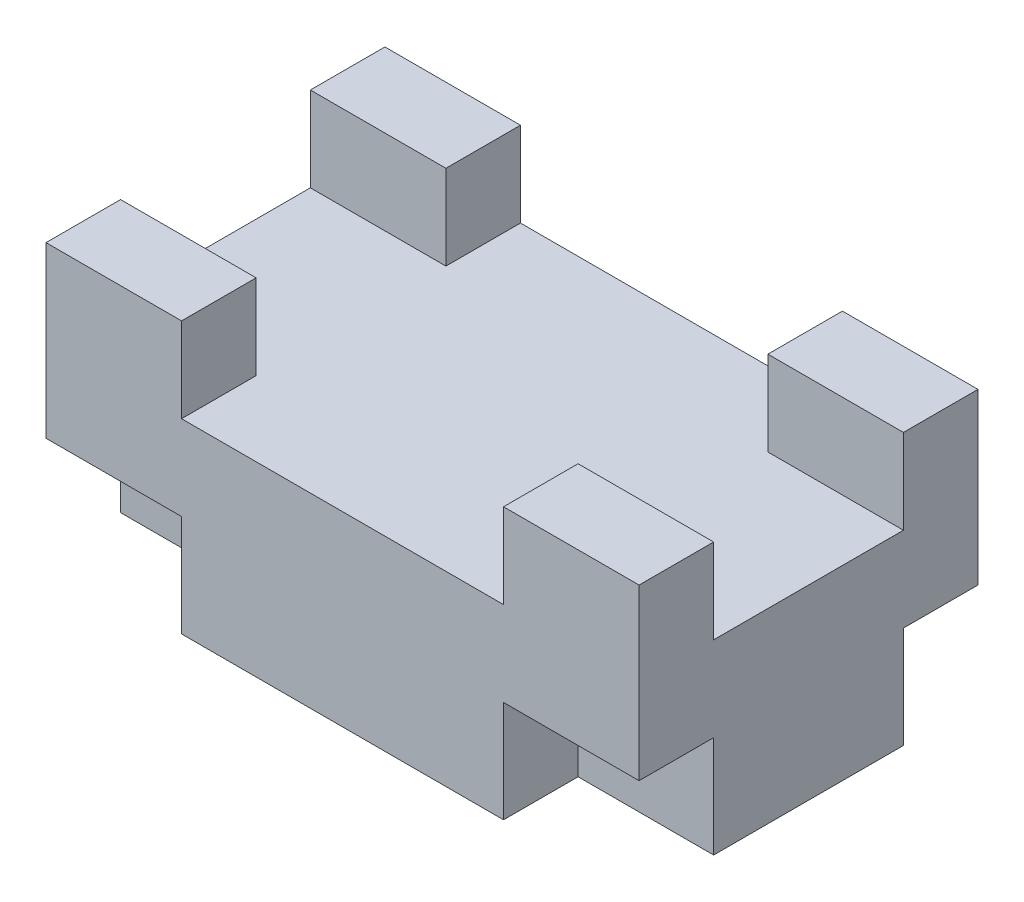
from build123d import *

# Parameters (mm, degrees)
BOSS_EXTRUDE1_DEPTH = 30
BOSS_EXTRUDE2_START = 30
SKETCH2_3_W         = 40
SKETCH2_3_H         = 22
BOSS_EXTRUDE2_DEPTH = 25
BOSS_EXTRUDE3_START = 55
SKETCH2_5_W         = 40
SKETCH2_5_H         = 22
BOSS_EXTRUDE3_DEPTH = 25


with BuildPart() as part:
    # Sketch2 → Boss-Extrude1 (new body)
    with BuildSketch(Plane(origin=(0, 0, 0), x_dir=(1, 0, 0), z_dir=(0, 1, 0))):
        Polygon((-47.5, -28), (-47.5, -50), (47.5, -50), (47.5, -28), (87.5, -28), (87.5, 28), (47.5, 28), (47.5, 50), (-47.5, 50), (-47.5, 28), (-87.5, 28), (-87.5, -28), align=None)
    extrude(amount=BOSS_EXTRUDE1_DEPTH)

    # Sketch2<3> → Boss-Extrude2 (add)
    with BuildSketch(Plane(origin=(0, 0, 0), x_dir=(1, 0, 0), z_dir=(0, 1, 0)).offset(BOSS_EXTRUDE2_START)):
        with Locations((-67.5, -39)):
            Rectangle(SKETCH2_3_W, SKETCH2_3_H)
        with Locations((-67.5, 39)):
            Rectangle(SKETCH2_3_W, SKETCH2_3_H)
        with Locations((67.5, 39)):
            Rectangle(SKETCH2_3_W, SKETCH2_3_H)
        with Locations((67.5, -39)):
            Rectangle(SKETCH2_3_W, SKETCH2_3_H)
        Polygon((-47.5, -28), (-47.5, -50), (47.5, -50), (47.5, -28), (87.5, -28), (87.5, 28), (47.5, 28), (47.5, 50), (-47.5, 50), (-47.5, 28), (-87.5, 28), (-87.5, -28), align=None)
    extrude(amount=BOSS_EXTRUDE2_DEPTH)

    # Sketch2<5> → Boss-Extrude3 (add)
    with BuildSketch(Plane(origin=(0, 0, 0), x_dir=(1, 0, 0), z_dir=(0, 1, 0)).offset(BOSS_EXTRUDE3_START)):
        with Locations((-67.5, -39)):
            Rectangle(SKETCH2_5_W, SKETCH2_5_H)
        with Locations((-67.5, 39)):
            Rectangle(SKETCH2_5_W, SKETCH2_5_H)
        with Locations((67.5, 39)):
            Rectangle(SKETCH2_5_W, SKETCH2_5_H)
        with Locations((67.5, -39)):
            Rectangle(SKETCH2_5_W, SKETCH2_5_H)
    extrude(amount=BOSS_EXTRUDE3_DEPTH)


solid = part.part
